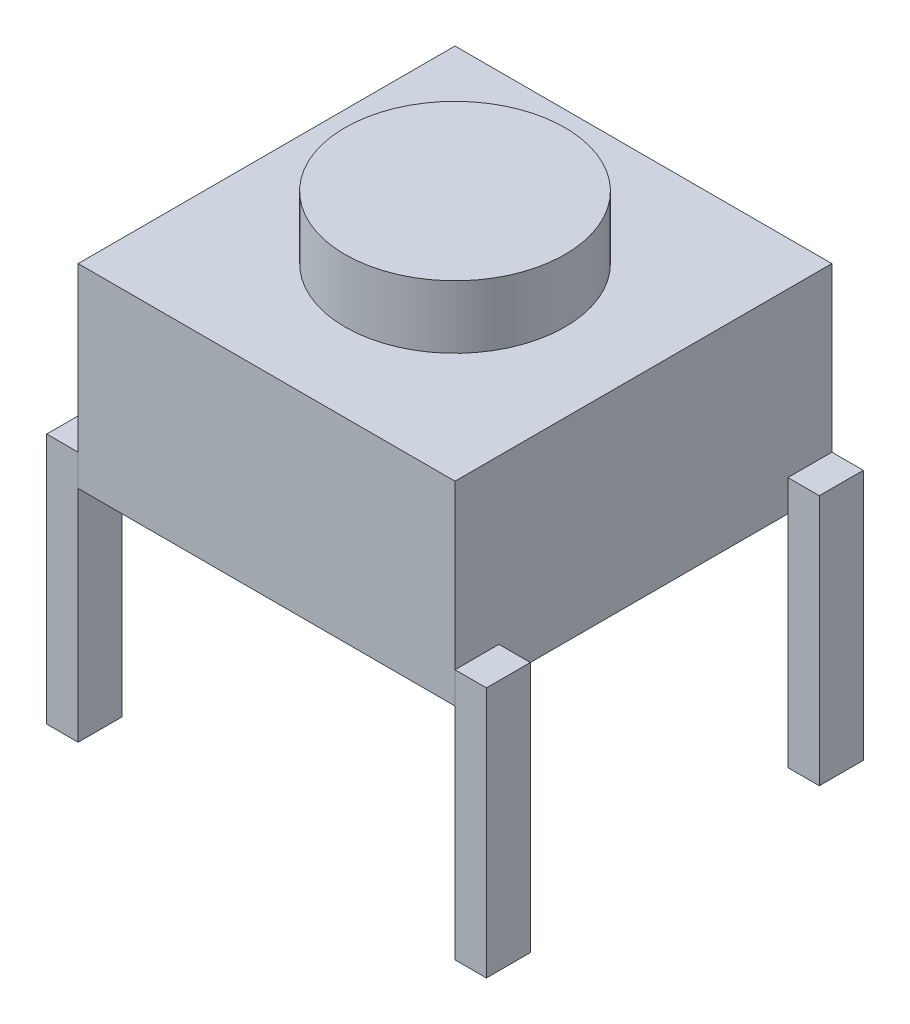
from build123d import *

# Parameters (mm, degrees)
SKETCH1_W             = 6
SKETCH1_H             = 6
BOSS_EXTRUDE1_DEPTH   = 3.1
SKETCH2_R             = 1.75
BOSS_EXTRUDE2_DEPTH   = 1
SKETCH3_W             = 0.5
SKETCH3_H             = 4
BOSS_EXTRUDE3_DEPTH   = 0.7
BOSS_EXTRUDE3_2_DEPTH = 0.7
SKETCH4_W             = 0.5
SKETCH4_H             = 4
BOSS_EXTRUDE4_DEPTH   = 0.7
BOSS_EXTRUDE4_2_DEPTH = 0.7


with BuildPart() as part:
    # Sketch1 → Boss-Extrude1 (new body)
    with BuildSketch(Plane(origin=(0, 0, 0), x_dir=(1, 0, 0), z_dir=(0, 1, 0))):
        Rectangle(SKETCH1_W, SKETCH1_H)
    extrude(amount=BOSS_EXTRUDE1_DEPTH)

    # Sketch2 → Boss-Extrude2 (add)
    with BuildSketch(Plane(origin=(0, 3.1, 0), x_dir=(1, 0, 0), z_dir=(0, 1, 0))):
        with Locations(Location((0, 0, 0), (0, 0, 270))):
            Circle(SKETCH2_R)
    extrude(amount=BOSS_EXTRUDE2_DEPTH)


with BuildPart() as body_2:
    # Sketch3 → Boss-Extrude3 (new body)
    with BuildSketch(Plane.XY.offset(3)):
        with Locations((3.25, -1.5)):
            Rectangle(SKETCH3_W, SKETCH3_H)
    extrude(amount=-BOSS_EXTRUDE3_DEPTH)


with BuildPart() as body_3:
    # Sketch3 → Boss-Extrude3 2 (new body)
    with BuildSketch(Plane.XY.offset(3)):
        with Locations((-3.25, -1.5)):
            Rectangle(SKETCH3_W, SKETCH3_H)
    extrude(amount=-BOSS_EXTRUDE3_2_DEPTH)


with BuildPart() as body_4:
    # Sketch4 → Boss-Extrude4 (new body)
    with BuildSketch(Plane(origin=(0, 0, -3), x_dir=(-1, 0, 0), z_dir=(0, 0, -1))):
        with Locations((-3.25, -1.5)):
            Rectangle(SKETCH4_W, SKETCH4_H)
    extrude(amount=-BOSS_EXTRUDE4_DEPTH)


with BuildPart() as body_5:
    # Sketch4 → Boss-Extrude4 2 (new body)
    with BuildSketch(Plane(origin=(0, 0, -3), x_dir=(-1, 0, 0), z_dir=(0, 0, -1))):
        with Locations((3.25, -1.5)):
            Rectangle(SKETCH4_W, SKETCH4_H)
    extrude(amount=-BOSS_EXTRUDE4_2_DEPTH)


solid = Compound([part.part, body_2.part, body_3.part, body_4.part, body_5.part])
